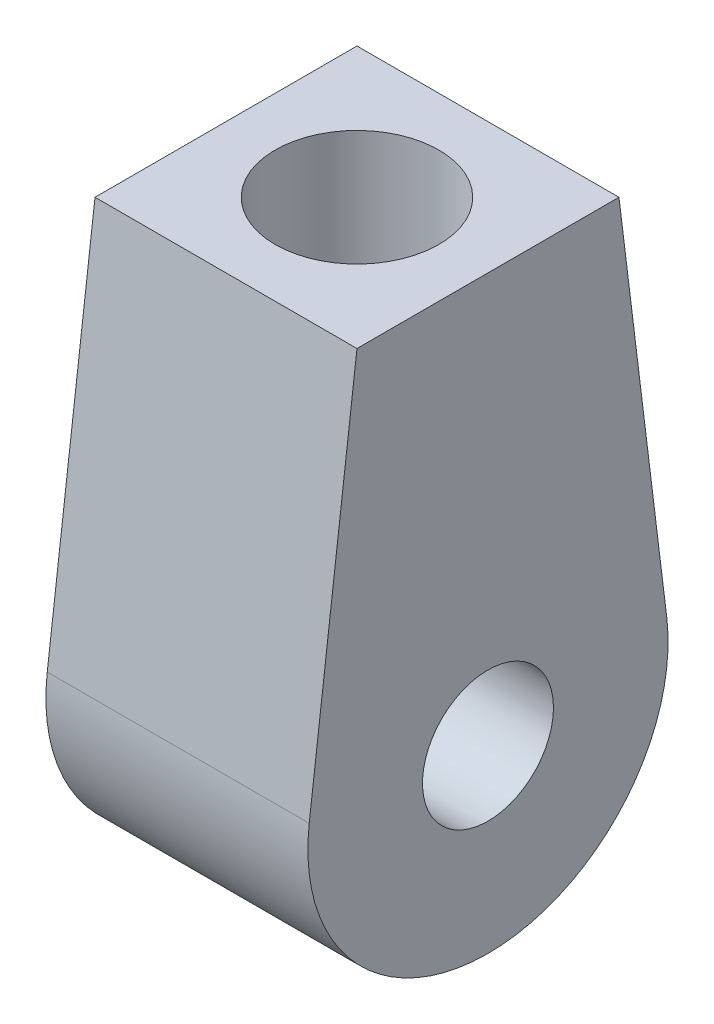
from build123d import *

# Parameters (mm, degrees)
IZIM1_R                     = 8
Y_KSEKLIK_EKSTR_ZYON1_DEPTH = 32
IZIM2_R                     = 10
KES_EKSTR_ZYON1_DEPTH       = 38


with BuildPart() as part:
    # Çizim1 → Yükseklik-Ekstrüzyon1 (new body)
    with BuildSketch(Plane(origin=(0, 0, 0), x_dir=(0, 0, -1), z_dir=(1, 0, 0))):
        with BuildLine():
            Line((-74.694543473, -11.370690029), (-68.859982056, 35.936369625))
            Line((-68.859982056, 35.936369625), (-36.859982056, 35.936369625))
            Line((-36.859982056, 35.936369625), (-31.001531459, -11.572016946))
            ThreePointArc((-31.001531459, -11.572016946), (-52.961351702, -36.063396833), (-74.694543473, -11.370690029))
        make_face()
        with Locations((-52.859982056, -14.063630375)):
            Circle(IZIM1_R, mode=Mode.SUBTRACT)
    extrude(amount=Y_KSEKLIK_EKSTR_ZYON1_DEPTH)

    # Çizim2 → Kes-Ekstrüzyon1 (cut)
    with BuildSketch(Plane(origin=(0, 35.936369625, 0), x_dir=(1, 0, 0), z_dir=(0, 1, 0))):
        with Locations(Location((16, -52.859982056, 0), (0, 0, 270))):
            Circle(IZIM2_R)
    extrude(amount=-KES_EKSTR_ZYON1_DEPTH, mode=Mode.SUBTRACT)


solid = part.part
